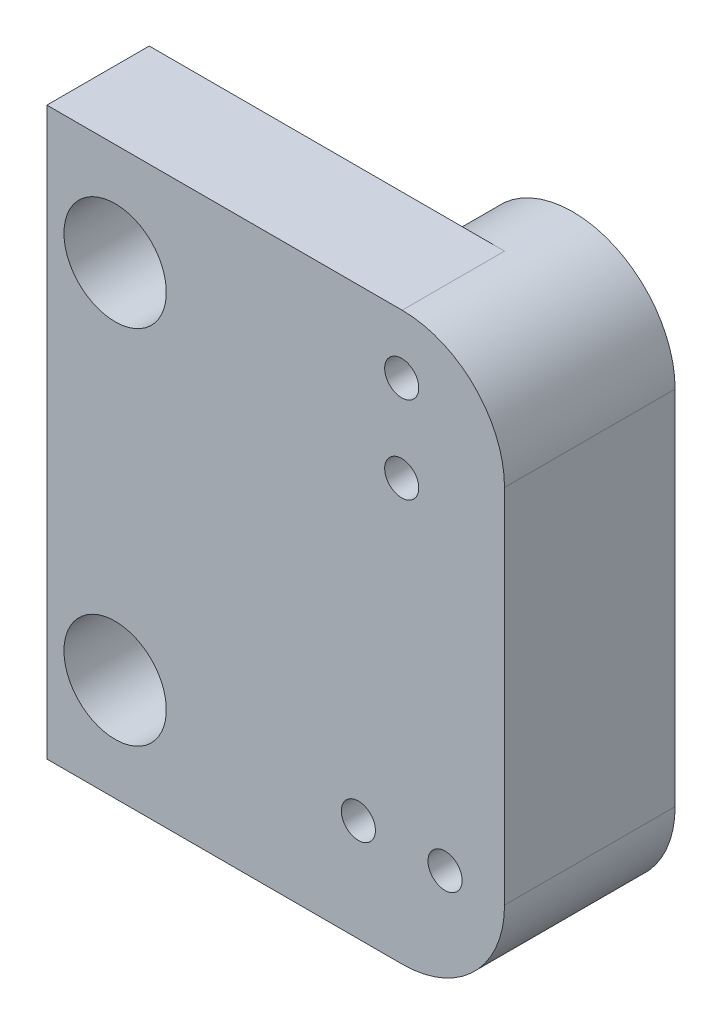
from build123d import *

# Parameters (mm, degrees)
SKETCH1_R               = 2.5
BOSS_EXTRUDE1_DEPTH     = 5
SKETCH2_R               = 2.51348819
BOSS_EXTRUDE2_DEPTH     = 1
BOSS_EXTRUDE3_DEPTH     = 3
CUT_EXTRUDE1_DEPTH      = 28.128538457
CUT_EXTRUDE1_DEPTH_BACK = 28.128538457
SKETCH5_R               = 0.5
CUT_EXTRUDE2_START      = -10
SKETCH6_R               = 1.5
CUT_EXTRUDE2_DEPTH      = 10


with BuildPart() as part:
    # Sketch1 → Boss-Extrude1 (new body)
    with BuildSketch(Plane(origin=(0, 0, -3.289858219), x_dir=(-1, 0, 0), z_dir=(0, 0, -1))):
        with BuildLine():
            Line((2.125597577, 8.274515134), (2.125597577, 18.874515134))
            ThreePointArc((2.125597577, 18.874515134), (5.125597577, 21.874515134), (8.125597577, 18.874515134))
            Line((8.125597577, 18.874515134), (8.125597577, 8.274515134))
            ThreePointArc((8.125597577, 8.274515134), (5.125597577, 5.274515134), (2.125597577, 8.274515134))
        make_face()
        with Locations((5.125597577, 18.874515134)):
            Circle(SKETCH1_R, mode=Mode.SUBTRACT)
        with Locations((5.125597577, 8.274515134)):
            Circle(SKETCH1_R, mode=Mode.SUBTRACT)
    extrude(amount=BOSS_EXTRUDE1_DEPTH)

    # Sketch2 → Boss-Extrude2 (add)
    with BuildSketch(Plane(origin=(0, 0, -3.289858219), x_dir=(-1, 0, 0), z_dir=(0, 0, -1))):
        with Locations((5.139085766, 8.274515134)):
            Circle(SKETCH2_R)
        with Locations((5.139085766, 18.874515134)):
            Circle(SKETCH2_R)
    extrude(amount=BOSS_EXTRUDE2_DEPTH)

    # Sketch4 → Boss-Extrude3 (add)
    with BuildSketch(Plane(origin=(0, 0, -3.289858219), x_dir=(-1, 0, 0), z_dir=(0, 0, -1))):
        with BuildLine():
            Line((-9.960914234, 18.874515134), (-10.460914234, 18.874515134))
            Line((-10.460914234, 18.874515134), (-10.460914234, 8.274515134))
            Line((-10.460914234, 8.274515134), (-9.960914234, 8.274515134))
            ThreePointArc((-9.960914234, 8.274515134), (-8.460914234, 9.774515134), (-6.960914234, 8.274515134))
            Line((-6.960914234, 8.274515134), (5.139085766, 8.274515134))
            Line((5.139085766, 8.274515134), (12.039085766, 8.274515134))
            ThreePointArc((12.039085766, 8.274515134), (13.539085766, 9.774515134), (15.039085766, 8.274515134))
            Line((15.039085766, 8.274515134), (15.539085766, 8.274515134))
            Line((15.539085766, 8.274515134), (15.539085766, 18.874515134))
            Line((15.539085766, 18.874515134), (15.039085766, 18.874515134))
            ThreePointArc((15.039085766, 18.874515134), (13.539085766, 17.374515134), (12.039085766, 18.874515134))
            Line((12.039085766, 18.874515134), (5.139085766, 18.874515134))
            Line((5.139085766, 18.874515134), (-6.960914234, 18.874515134))
            ThreePointArc((-6.960914234, 18.874515134), (-8.460914234, 17.374515134), (-9.960914234, 18.874515134))
        make_face()
        with BuildLine():
            Line((15.539085766, 21.874515134), (5.125597577, 21.874515134))
            Line((5.125597577, 21.874515134), (-10.460914234, 21.874515134))
            Line((-10.460914234, 21.874515134), (-10.460914234, 18.874515134))
            Line((-10.460914234, 18.874515134), (-9.960914234, 18.874515134))
            ThreePointArc((-9.960914234, 18.874515134), (-8.460914234, 20.374515134), (-6.960914234, 18.874515134))
            Line((-6.960914234, 18.874515134), (5.139085766, 18.874515134))
            Line((5.139085766, 18.874515134), (12.039085766, 18.874515134))
            ThreePointArc((12.039085766, 18.874515134), (13.539085766, 20.374515134), (15.039085766, 18.874515134))
            Line((15.039085766, 18.874515134), (15.539085766, 18.874515134))
            Line((15.539085766, 18.874515134), (15.539085766, 21.874515134))
        make_face()
        with BuildLine():
            Line((-9.960914234, 8.274515134), (-10.460914234, 8.274515134))
            Line((-10.460914234, 8.274515134), (-10.460914234, 5.274515134))
            Line((-10.460914234, 5.274515134), (5.125597577, 5.274515134))
            Line((5.125597577, 5.274515134), (15.539085766, 5.274515134))
            Line((15.539085766, 5.274515134), (15.539085766, 8.274515134))
            Line((15.539085766, 8.274515134), (15.039085766, 8.274515134))
            ThreePointArc((15.039085766, 8.274515134), (13.539085766, 6.774515134), (12.039085766, 8.274515134))
            Line((12.039085766, 8.274515134), (5.139085766, 8.274515134))
            Line((5.139085766, 8.274515134), (-6.960914234, 8.274515134))
            ThreePointArc((-6.960914234, 8.274515134), (-8.460914234, 6.774515134), (-9.960914234, 8.274515134))
        make_face()
    extrude(amount=BOSS_EXTRUDE3_DEPTH)

    # Sketch5 → Cut-Extrude1 (cut, two sides: drawn at the far end of the back side and taken through both)
    with BuildSketch(Plane(origin=(0, 0, -4.289858219), x_dir=(-1, 0, 0), z_dir=(0, 0, -1)).offset(-CUT_EXTRUDE1_DEPTH_BACK)):
        with Locations((5.139085766, 20.144515134)):
            Circle(SKETCH5_R)
        with Locations((5.139085766, 17.604515134)):
            Circle(SKETCH5_R)
        with Locations((3.869085766, 8.274515134)):
            Circle(SKETCH5_R)
        with Locations((6.409085766, 8.274515134)):
            Circle(SKETCH5_R)
    extrude(amount=CUT_EXTRUDE1_DEPTH + CUT_EXTRUDE1_DEPTH_BACK, mode=Mode.SUBTRACT)

    # Sketch6 → Cut-Extrude2 (cut)
    with BuildSketch(Plane(origin=(0, 0, -6.289858219), x_dir=(-1, 0, 0), z_dir=(0, 0, -1)).offset(CUT_EXTRUDE2_START)):
        with BuildLine():
            Line((-10.460914234, 5.274515134), (5.125597577, 5.274515134))
            ThreePointArc((5.125597577, 5.274515134), (3.004277233, 6.15319479), (2.125597577, 8.274515134))
            Line((2.125597577, 8.274515134), (2.125597577, 18.874515134))
            ThreePointArc((2.125597577, 18.874515134), (3.004277233, 20.995835477), (5.125597577, 21.874515134))
            Line((5.125597577, 21.874515134), (-10.460914234, 21.874515134))
            Line((-10.460914234, 21.874515134), (-10.460914234, 5.274515134))
        make_face()
        with Locations((-8.460914234, 18.874515134)):
            Circle(SKETCH6_R, mode=Mode.SUBTRACT)
        with Locations((-8.460914234, 8.274515134)):
            Circle(SKETCH6_R, mode=Mode.SUBTRACT)
    extrude(amount=CUT_EXTRUDE2_DEPTH, mode=Mode.SUBTRACT)


solid = part.part
